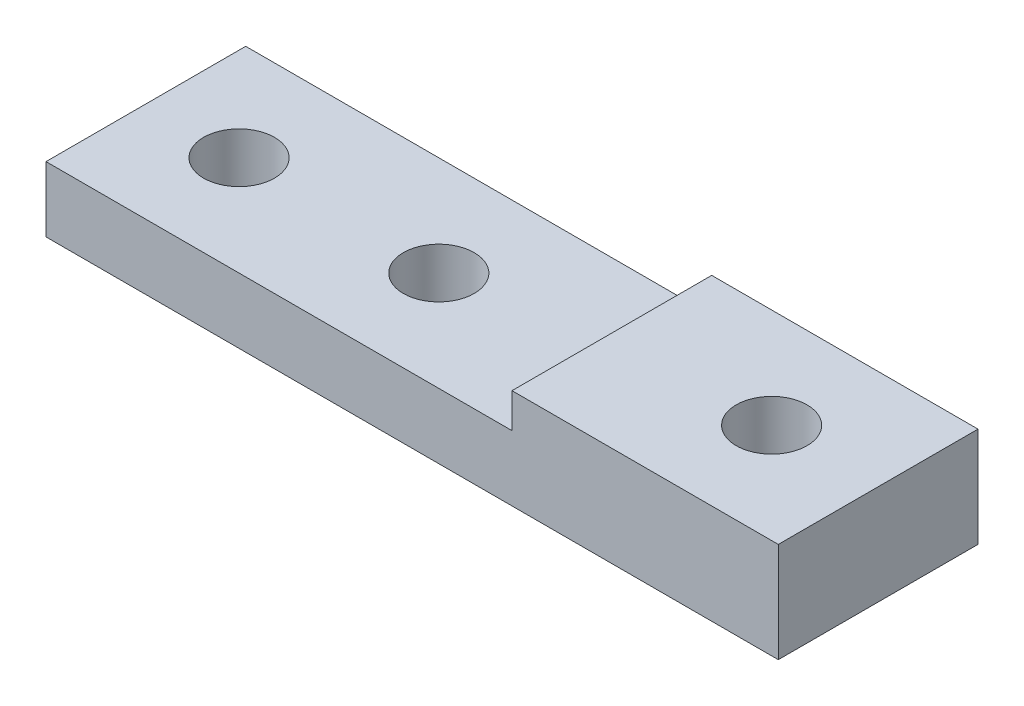
from build123d import *

# Parameters (mm, degrees)
SKETCH1_W               = 69.85
SKETCH1_H               = 19.05
BOSS_EXTRUDE1_DEPTH     = 6.223
SKETCH4_W               = 25.4
SKETCH4_H               = 19.05
BOSS_EXTRUDE2_DEPTH     = 3.302
F_1_4_CLEARANCE_HOLE2_D = 6.7564


with BuildPart() as part:
    # Sketch1 → Boss-Extrude1 (new body)
    with BuildSketch(Plane(origin=(0, 0, 0), x_dir=(1, 0, 0), z_dir=(0, 1, 0))):
        Rectangle(SKETCH1_W, SKETCH1_H)
    extrude(amount=BOSS_EXTRUDE1_DEPTH)

    # Sketch4 → Boss-Extrude2 (add)
    with BuildSketch(Plane(origin=(0, 6.223, 0), x_dir=(1, 0, 0), z_dir=(0, 1, 0))):
        with Locations((22.225, 0)):
            Rectangle(SKETCH4_W, SKETCH4_H)
    extrude(amount=BOSS_EXTRUDE2_DEPTH)

    # 1/4 Clearance Hole2 (through all)
    with Locations(Plane(origin=(0, 0, 0), x_dir=(-1, 0, 0), z_dir=(0, -1, 0))):
        with Locations((-24.765, 0), (6.985, 0), (26.035, 0)):
            Hole(F_1_4_CLEARANCE_HOLE2_D / 2)


solid = part.part
